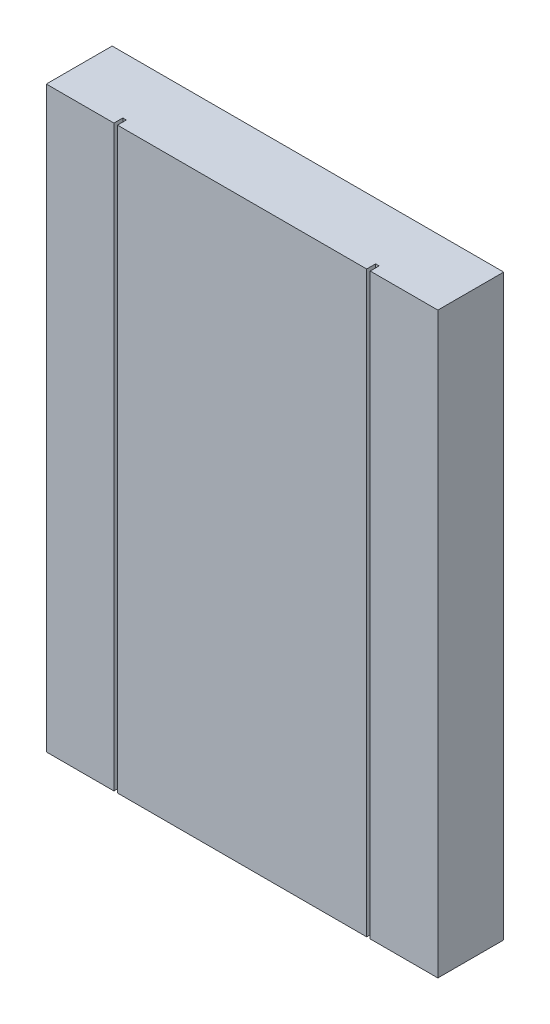
from build123d import *

# Parameters (mm, degrees)
SKETCH1_W               = 55.88
SKETCH1_H               = 82.55
BOSS_EXTRUDE1_DEPTH     = 9.398
CUT_EXTRUDE_THIN1_START = -1.27
SKETCH2_W               = 0.508
SKETCH2_H               = 82.55
CUT_EXTRUDE_THIN1_DEPTH = 52.99072189


with BuildPart() as part:
    # Sketch1 → Boss-Extrude1 (new body)
    with BuildSketch(Plane.XY):
        Rectangle(SKETCH1_W, SKETCH1_H)
    extrude(amount=BOSS_EXTRUDE1_DEPTH)

    # Sketch2 → Cut-Extrude-Thin1 (cut)
    with BuildSketch(Plane.XY.offset(9.398).offset(CUT_EXTRUDE_THIN1_START)):
        with Locations((-18.034, 0)):
            Rectangle(SKETCH2_W, SKETCH2_H)
    cut_extrude_thin1 = extrude(amount=CUT_EXTRUDE_THIN1_DEPTH, mode=Mode.SUBTRACT)

    # Mirror1: Cut-Extrude-Thin1 across plane
    add(cut_extrude_thin1.mirror(Plane(origin=(0, 0, 0), x_dir=(0, 0, 1), z_dir=(1, 0, 0))), mode=Mode.SUBTRACT)


solid = part.part
